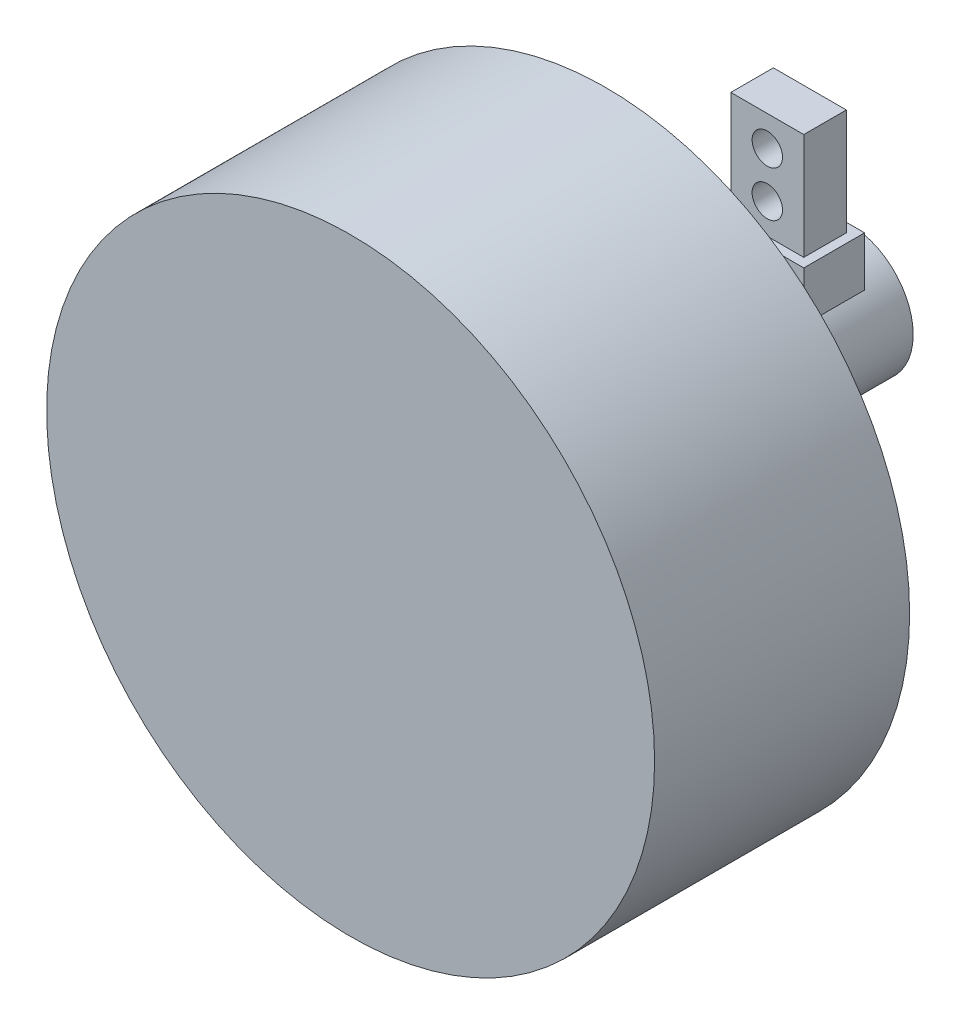
from build123d import *

# Parameters (mm, degrees)
SKETCH1_R          = 100
BODY_DEPTH         = 83.89
SKETCH2_R          = 20.985
SHAFT_DEPTH        = 80.18
MOUNT_START        = -6.309503
SKETCH5_W          = 30
SKETCH5_H          = 20
MOUNT_BASE_DEPTH   = 51.309503
SKETCH6_W          = 30
SKETCH6_H          = 20
SKETCH6_W_2        = 24
SKETCH6_H_2        = 14
MOUNT_TONGUE_DEPTH = 35
MOUNT_HOLES_REACH  = 208.935
SKETCH7_R          = 5


with BuildPart() as part:
    # Sketch1 → Body (new body)
    with BuildSketch(Plane.XY):
        Circle(SKETCH1_R)
    extrude(amount=BODY_DEPTH)

    # Sketch2 → Shaft (add)
    with BuildSketch(Plane.XY):
        Circle(SKETCH2_R)
    extrude(amount=-SHAFT_DEPTH)

    # Sketch5 → Mount Base (add)
    with BuildSketch(Plane(origin=(0, 20.985, 0), x_dir=(1, 0, 0), z_dir=(0, 1, 0)).offset(MOUNT_START)):
        with Locations((0, 60.18)):
            Rectangle(SKETCH5_W, SKETCH5_H)
    extrude(amount=MOUNT_BASE_DEPTH)

    # Sketch6 → Mount Tongue (cut)
    with BuildSketch(Plane(origin=(0, 65.985, 0), x_dir=(1, 0, 0), z_dir=(0, 1, 0))):
        with Locations((0, 60.18)):
            Rectangle(SKETCH6_W, SKETCH6_H)
        with Locations((0, 60.18)):
            Rectangle(SKETCH6_W_2, SKETCH6_H_2, mode=Mode.SUBTRACT)
    extrude(amount=-MOUNT_TONGUE_DEPTH, mode=Mode.SUBTRACT)

    # Sketch7 → Mount Holes (cut, up to next)
    with BuildSketch(Plane(origin=(0, 0, -67.18), x_dir=(-1, 0, 0), z_dir=(0, 0, -1)), mode=Mode.PRIVATE) as mount_holes_sk1:
        with Locations((0, 40.985)):
            Circle(SKETCH7_R)
    mount_holes_tool1 = extrude(mount_holes_sk1.sketch, amount=-MOUNT_HOLES_REACH, mode=Mode.PRIVATE) & part.part
    # Sketch7 → Mount Holes (cut, up to next)
    with BuildSketch(Plane(origin=(0, 0, -67.18), x_dir=(-1, 0, 0), z_dir=(0, 0, -1)), mode=Mode.PRIVATE) as mount_holes_sk2:
        with Locations((0, 55.985)):
            Circle(SKETCH7_R)
    mount_holes_tool2 = extrude(mount_holes_sk2.sketch, amount=-MOUNT_HOLES_REACH, mode=Mode.PRIVATE) & part.part
    add(mount_holes_tool1.solids().sort_by_distance((0, 40.985, -67.18))[0], mode=Mode.SUBTRACT)
    add(mount_holes_tool2.solids().sort_by_distance((0, 55.985, -67.18))[0], mode=Mode.SUBTRACT)


solid = part.part
